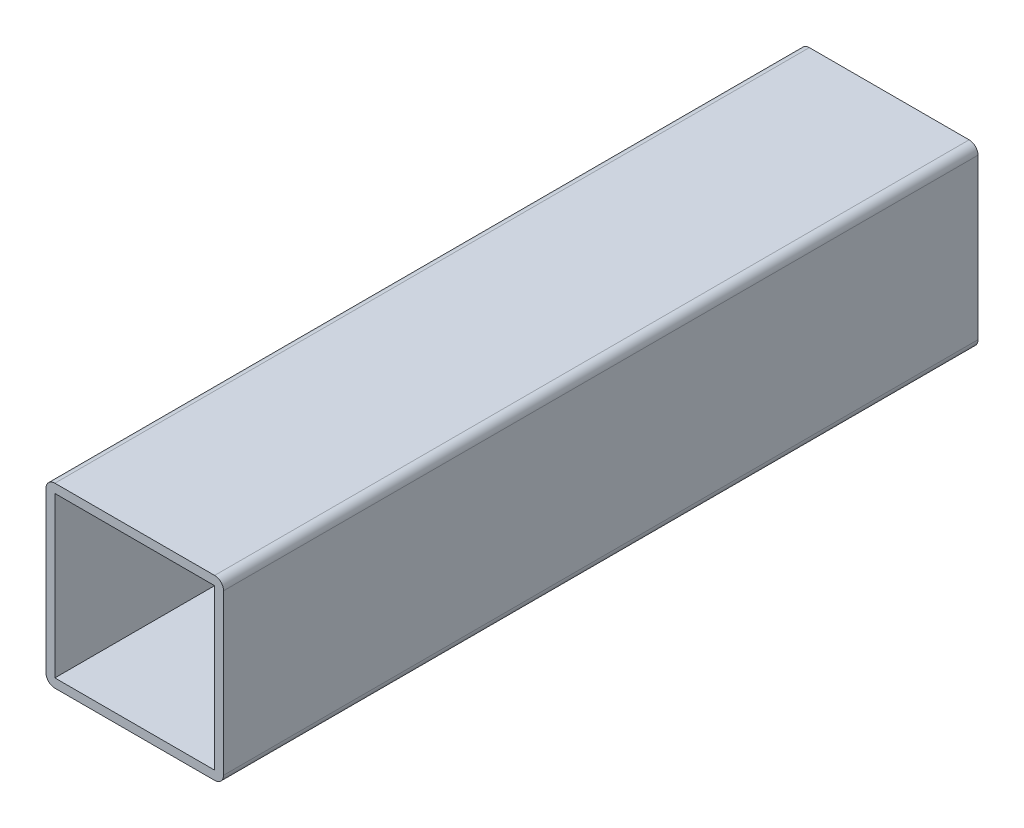
from build123d import *

# Parameters (mm, degrees)
IZIM1_W                     = 72
IZIM1_H                     = 72
Y_KSEKLIK_EKSTR_ZYON1_DEPTH = 340


with BuildPart() as part:
    # Çizim1 → Yükseklik-Ekstrüzyon1 (new body)
    with BuildSketch(Plane.XY):
        with BuildLine():
            Line((-36, 40), (36, 40))
            ThreePointArc((36, 40), (38.828427125, 38.828427125), (40, 36))
            Line((40, 36), (40, -36))
            ThreePointArc((40, -36), (38.828427125, -38.828427125), (36, -40))
            Line((36, -40), (-36, -40))
            ThreePointArc((-36, -40), (-38.828427125, -38.828427125), (-40, -36))
            Line((-40, -36), (-40, 36))
            ThreePointArc((-40, 36), (-38.828427125, 38.828427125), (-36, 40))
        make_face()
        Rectangle(IZIM1_W, IZIM1_H, mode=Mode.SUBTRACT)
    extrude(amount=Y_KSEKLIK_EKSTR_ZYON1_DEPTH)


solid = part.part
